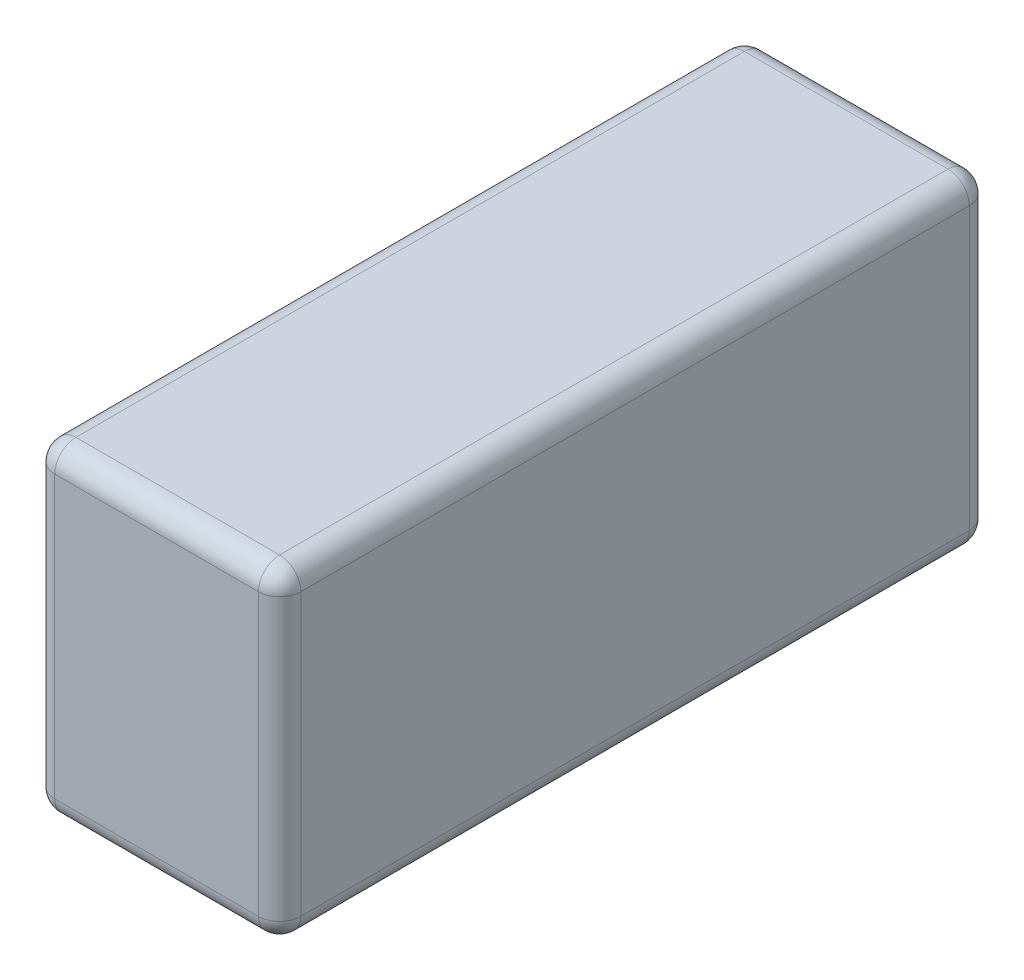
from build123d import *

# Parameters (mm, degrees)
SKETCH_1_W      = 23.2
SKETCH_1_H      = 67
EXTRUDE_1_DEPTH = 30.5
FILLET_2_R      = 2


with BuildPart() as part:
    # Эскиз1 → Бобышка-Вытянуть1 (new body)
    with BuildSketch(Plane(origin=(0, 0, 0), x_dir=(1, 0, 0), z_dir=(0, 1, 0))):
        Rectangle(SKETCH_1_W, SKETCH_1_H)
    extrude(amount=EXTRUDE_1_DEPTH)

    # Скругление2
    fillet_2_edges = [part.edges().sort_by_distance(p)[0] for p in [
        (-11.6, 30.5, 0),
        (0, 30.5, 33.5),
        (11.6, 30.5, 0),
        (0, 0, 33.5),
        (-11.6, 0, 0),
        (0, 0, -33.5),
        (11.6, 0, 0),
        (0, 30.5, -33.5),
        (11.6, 15.25, 33.5),
        (-11.6, 15.25, 33.5),
        (-11.6, 15.25, -33.5),
        (11.6, 15.25, -33.5),
    ]]
    fillet(fillet_2_edges, radius=FILLET_2_R)


solid = part.part
